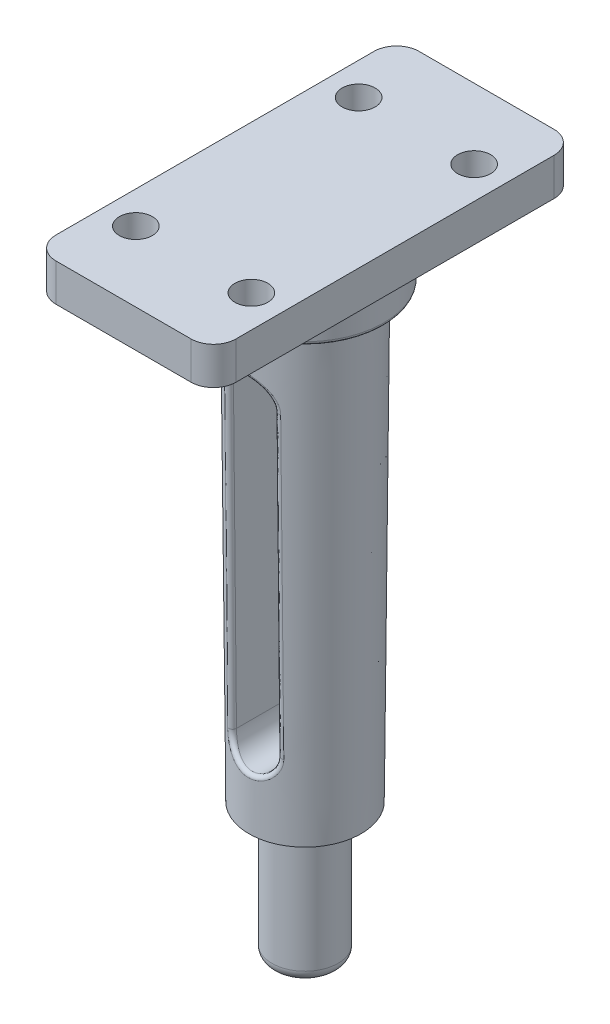
from build123d import *

# Parameters (mm, degrees)
SKETCH1_W           = 24
SKETCH1_H           = 48.4
BOSS_EXTRUDE1_DEPTH = 5
SKETCH3_R           = 10.5
BOSS_EXTRUDE3_DEPTH = 5
SKETCH4_R           = 8
BOSS_EXTRUDE4_DEPTH = 60
BOSS_EXTRUDE4_TAPER = 0.5
SKETCH5_R           = 2.2
CUT_EXTRUDE1_DEPTH  = 5
SKETCH6_R           = 4.4
BOSS_EXTRUDE5_DEPTH = 18
CUT_EXTRUDE2_DEPTH  = 100
FILLET2_R           = 3
FILLET3_R           = 1.5
FILLET4_R           = 0.5


with BuildPart() as part:
    # Sketch1 → Boss-Extrude1 (new body)
    with BuildSketch(Plane(origin=(0, 0, 0), x_dir=(1, 0, 0), z_dir=(0, 1, 0))):
        Rectangle(SKETCH1_W, SKETCH1_H)
    extrude(amount=BOSS_EXTRUDE1_DEPTH)

    # Sketch3 → Boss-Extrude3 (add)
    with BuildSketch(Plane.XZ):
        with Locations(Location((0, 0, 0), (0, 0, 270))):
            Circle(SKETCH3_R)
    extrude(amount=BOSS_EXTRUDE3_DEPTH)

    # Sketch4 → Boss-Extrude4 (add)
    with BuildSketch(Plane.XZ.offset(5)):
        Circle(SKETCH4_R)
    extrude(amount=BOSS_EXTRUDE4_DEPTH, taper=BOSS_EXTRUDE4_TAPER)

    # Sketch5 → Cut-Extrude1 (cut)
    with BuildSketch(Plane(origin=(0, 5, 0), x_dir=(1, 0, 0), z_dir=(0, 1, 0))):
        with Locations(Location((-7.7, 14.85, 0), (0, 0, 270))):
            Circle(SKETCH5_R)
        with Locations(Location((7.7, 14.85, 0), (0, 0, 90))):
            Circle(SKETCH5_R)
        with Locations(Location((7.7, -14.85, 0), (0, 0, 270))):
            Circle(SKETCH5_R)
        with Locations(Location((-7.7, -14.85, 0), (0, 0, 90))):
            Circle(SKETCH5_R)
    extrude(amount=-CUT_EXTRUDE1_DEPTH, mode=Mode.SUBTRACT)

    # Sketch6 → Boss-Extrude5 (add)
    with BuildSketch(Plane.XZ.offset(65)):
        with Locations(Location((0, 0, 0), (0, 0, 270))):
            Circle(SKETCH6_R)
    extrude(amount=BOSS_EXTRUDE5_DEPTH)

    # Sketch8 → Cut-Extrude2 (cut, symmetric)
    with BuildSketch(Plane.XY):
        with BuildLine():
            Line((3, -55), (3, -15))
            ThreePointArc((3, -15), (0, -12), (-3, -15))
            Line((-3, -15), (-3, -55))
            ThreePointArc((-3, -55), (0, -58), (3, -55))
        make_face()
    extrude(amount=CUT_EXTRUDE2_DEPTH, both=True, mode=Mode.SUBTRACT)

    # Fillet2
    fillet2_edges = [part.edges().sort_by_distance(p)[0] for p in [
        (12, 2.5, 24.2),
        (-12, 2.5, 24.2),
        (-12, 2.5, -24.2),
        (12, 2.5, -24.2),
    ]]
    fillet(fillet2_edges, radius=FILLET2_R)

    # Fillet3
    fillet3_edges = [part.edges().sort_by_distance(p)[0] for p in [
        (0, -83, 4.4),
    ]]
    fillet(fillet3_edges, radius=FILLET3_R)

    # Fillet4
    fillet4_edges = [part.edges().sort_by_distance(p)[0] for p in [
        (0, 0, 10.5),
        (0, -5, 10.5),
        (-8, -5, 0),
        (0, -65, 4.4),
        (-3, -35.000003579, 7.132996942),
        (0, -58, 7.537476007),
        (3, -35.000003579, 7.132996942),
        (0, -12, 7.938911925),
        (-3, -35.000003579, -7.132996942),
        (0, -58, -7.537476007),
        (3, -35.000003579, -7.132996942),
        (0, -12, -7.938911925),
    ]]
    fillet(fillet4_edges, radius=FILLET4_R)


solid = part.part
